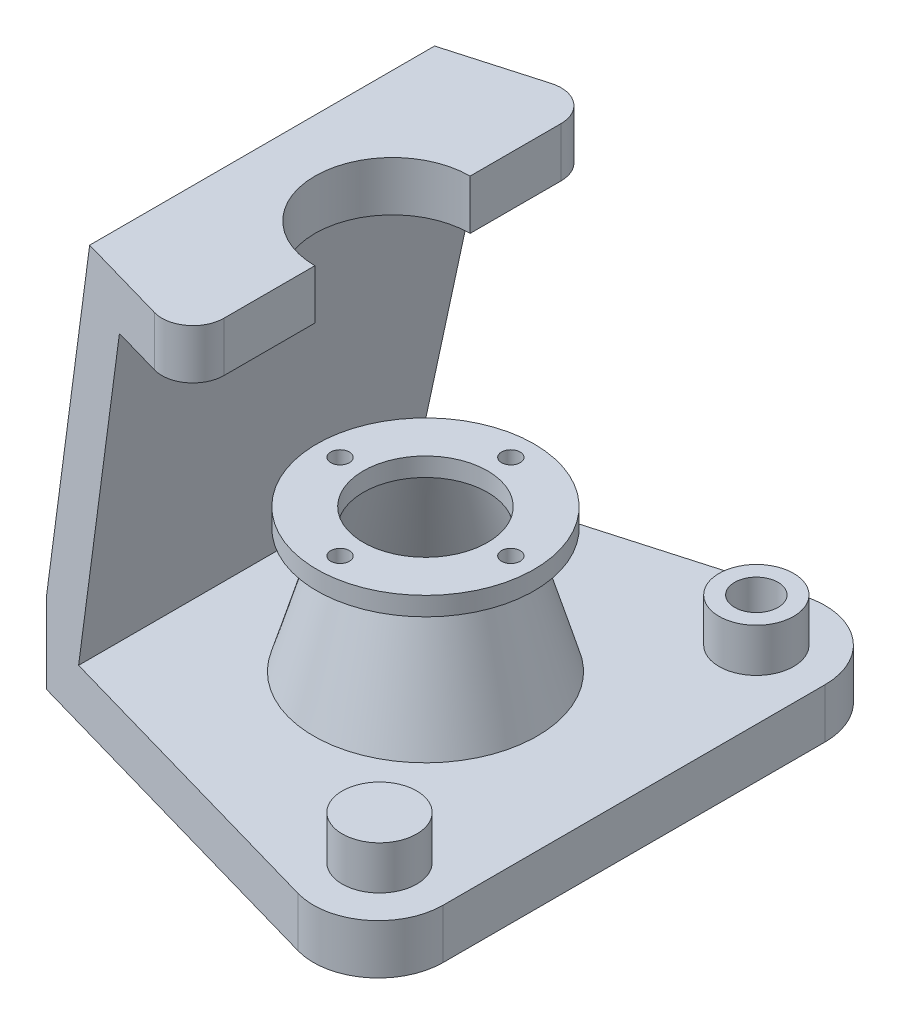
from build123d import *

# Parameters (mm, degrees)
SALIENTE_EXTRUIR1_DEPTH              = 90
CORTAR_EXTRUIR1_DEPTH                = 153.015667403
CORTAR_EXTRUIR1_DEPTH_BACK           = 153.015667403
CROQUIS2_OUTSIDE_W                   = 195.144
CROQUIS2_OUTSIDE_H                   = 235.144
REDONDEO1_R                          = 10
CROQUIS3_R                           = 12
SALIENTE_EXTRUIR2_DEPTH              = 14
CORTAR_EXTRUIR2_DEPTH                = 16
TALADRO1_D                           = 6
TALADRO1_DEPTH                       = 6
TALADRO_ROSCADO_M163_REACH           = 216.283
TALADRO_ROSCADO_M163_BORE_R          = 7
TALADRO_ROSCADO_M163_ON_FACE_2_REACH = 223.31
TALADRO_ROSCADO_M163_BORE_2_R        = 7


with BuildPart() as part:
    # Croquis1 → Saliente-Extruir1 (new, symmetric)
    with BuildSketch(Plane.XY):
        Polygon((-70, -35.859640122), (70, -35.859640122), (70, -19.859640122), (-55.587324838, -19.859640122), (-37.178438023, 84.54234499), (-8.604032122, 84.54234499), (-8.604032122, 100.54234499), (-50.604032122, 100.54234499), (-70, -9.45765501), align=None)
    extrude(amount=SALIENTE_EXTRUIR1_DEPTH, both=True)

    # Croquis2 outside → Cortar-Extruir1 (cut, two sides: drawn at the far end of the back side and taken through both)
    with BuildSketch(Plane(origin=(0, 0, 0), x_dir=(1, 0, 0), z_dir=(0, 1, 0)).offset(-CORTAR_EXTRUIR1_DEPTH_BACK)):
        Rectangle(CROQUIS2_OUTSIDE_W, CROQUIS2_OUTSIDE_H)
        with BuildLine():
            Line((-70, 50), (-70, -50))
            Line((-70, -50), (43.366457067, -82.390416305))
            ThreePointArc((43.366457067, -82.390416305), (61.688422944, -78.981093081), (70, -62.300697244))
            Line((70, -62.300697244), (70, 60.679009052))
            ThreePointArc((70, 60.679009052), (61.20181191, 78.335978242), (41.807165035, 81.944904296))
            Line((41.807165035, 81.944904296), (-70, 50))
        make_face(mode=Mode.SUBTRACT)
    extrude(amount=CORTAR_EXTRUIR1_DEPTH + CORTAR_EXTRUIR1_DEPTH_BACK, mode=Mode.SUBTRACT)

    # Redondeo1
    redondeo1_edges = [part.edges().sort_by_distance(p)[0] for p in [
        (-8.604032122, 92.54234499, -67.541705108),
        (-8.604032122, 92.54234499, 67.541705108),
    ]]
    fillet(redondeo1_edges, radius=REDONDEO1_R)

    # Croquis3 → Saliente-Extruir2 (add)
    with BuildSketch(Plane(origin=(0, -19.859640122, 0), x_dir=(1, 0, 0), z_dir=(0, 1, 0))):
        with Locations((47.883135105, 60.679009052)):
            Circle(CROQUIS3_R)
    saliente_extruir2 = extrude(amount=SALIENTE_EXTRUIR2_DEPTH)

    # Simetría4: Saliente-Extruir2 across plane
    add(saliente_extruir2.mirror(Plane.XY))

    # Croquis4 → Cortar-Extruir2 (cut)
    with BuildSketch(Plane(origin=(0, 100.54234499, 0), x_dir=(1, 0, 0), z_dir=(0, 1, 0))):
        with BuildLine():
            Line((-8.604032122, 25), (-8.604032122, -25))
            ThreePointArc((-8.604032122, -25), (-33.604032122, 0), (-8.604032122, 25))
        make_face()
    extrude(amount=-CORTAR_EXTRUIR2_DEPTH, mode=Mode.SUBTRACT)

    # Croquis5 → Revolución1 (revolve)
    with BuildSketch(Plane.XY, mode=Mode.PRIVATE) as revoluci_n1_sk:
        Polygon((37, 26.140359878), (37, 20.140359878), (26.171234463, 20.140359878), (38, -19.859640122), (33.828765537, -19.859640122), (22, 20.140359878), (22, 26.140359878), align=None)
    revolve(revoluci_n1_sk.sketch.rotate(Axis((2, -40.2659066, 0), (0, 1, 0)), 90), axis=Axis((2, -40.2659066, 0), (0, 1, 0)))

    # Taladro1
    with Locations(Plane(origin=(2, 26.140359878, -27.498672592), x_dir=(0, 0, 1), z_dir=(0, 1, 0))):
        with Locations((0, 0), (27.498673581, 27.497904202), (54.996574558, 0), (27.498672592, -27.501922028)):
            Hole(TALADRO1_D / 2, depth=TALADRO1_DEPTH)

    # Taladro roscado M163 bore (on position points) → Taladro roscado M163 (cut, up to next)
    with BuildSketch(Plane(origin=(47.883135105, -5.859640122, -60.679009052), x_dir=(1, 0, 0), z_dir=(0, 1, 0)), mode=Mode.PRIVATE) as taladro_roscado_m163_sk1:
        Circle(TALADRO_ROSCADO_M163_BORE_R)
    taladro_roscado_m163_tool1 = extrude(taladro_roscado_m163_sk1.sketch, amount=-TALADRO_ROSCADO_M163_REACH, mode=Mode.PRIVATE) & part.part
    add(taladro_roscado_m163_tool1.solids().sort_by_distance((47.883135, -5.85964, -60.679009))[0], mode=Mode.SUBTRACT)

    # Taladro roscado M163 bore 2 (on position points) → Taladro roscado M163 on face 2 (cut, up to next)
    with BuildSketch(Plane(origin=(47.883135105, -19.859640122, 60.679009052), x_dir=(1, 0, 0), z_dir=(0, 1, 0)), mode=Mode.PRIVATE) as taladro_roscado_m163_on_face_2_sk1:
        Circle(TALADRO_ROSCADO_M163_BORE_2_R)
    taladro_roscado_m163_on_face_2_tool1 = extrude(taladro_roscado_m163_on_face_2_sk1.sketch, amount=-TALADRO_ROSCADO_M163_ON_FACE_2_REACH, mode=Mode.PRIVATE) & part.part
    add(taladro_roscado_m163_on_face_2_tool1.solids().sort_by_distance((47.883135, -19.85964, 60.679009))[0], mode=Mode.SUBTRACT)


solid = part.part
